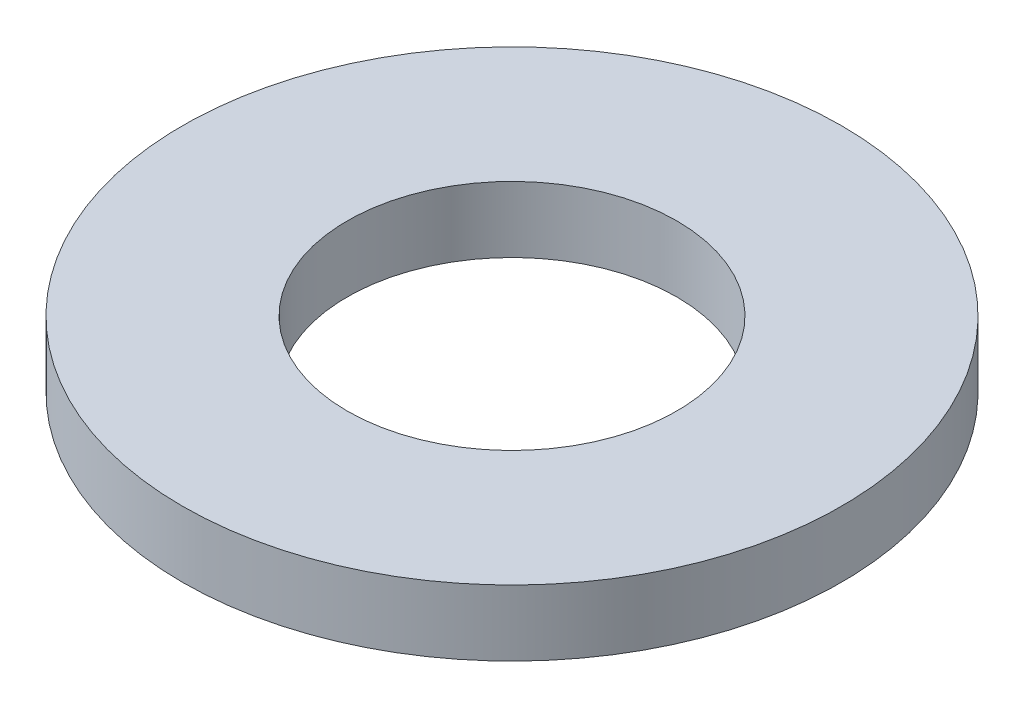
from build123d import *

# Parameters (mm, degrees)
SKETCH1_R           = 8
SKETCH1_R_2         = 4
BOSS_EXTRUDE1_DEPTH = 1.6


with BuildPart() as part:
    # Sketch1 → Boss-Extrude1 (new body)
    with BuildSketch(Plane(origin=(0, 0, 0), x_dir=(1, 0, 0), z_dir=(0, 1, 0))):
        with Locations(Location((0, 0, 0), (0, 0, 270))):
            Circle(SKETCH1_R)
        with Locations(Location((0, 0, 0), (0, 0, 270))):
            Circle(SKETCH1_R_2, mode=Mode.SUBTRACT)
    extrude(amount=BOSS_EXTRUDE1_DEPTH)


solid = part.part
